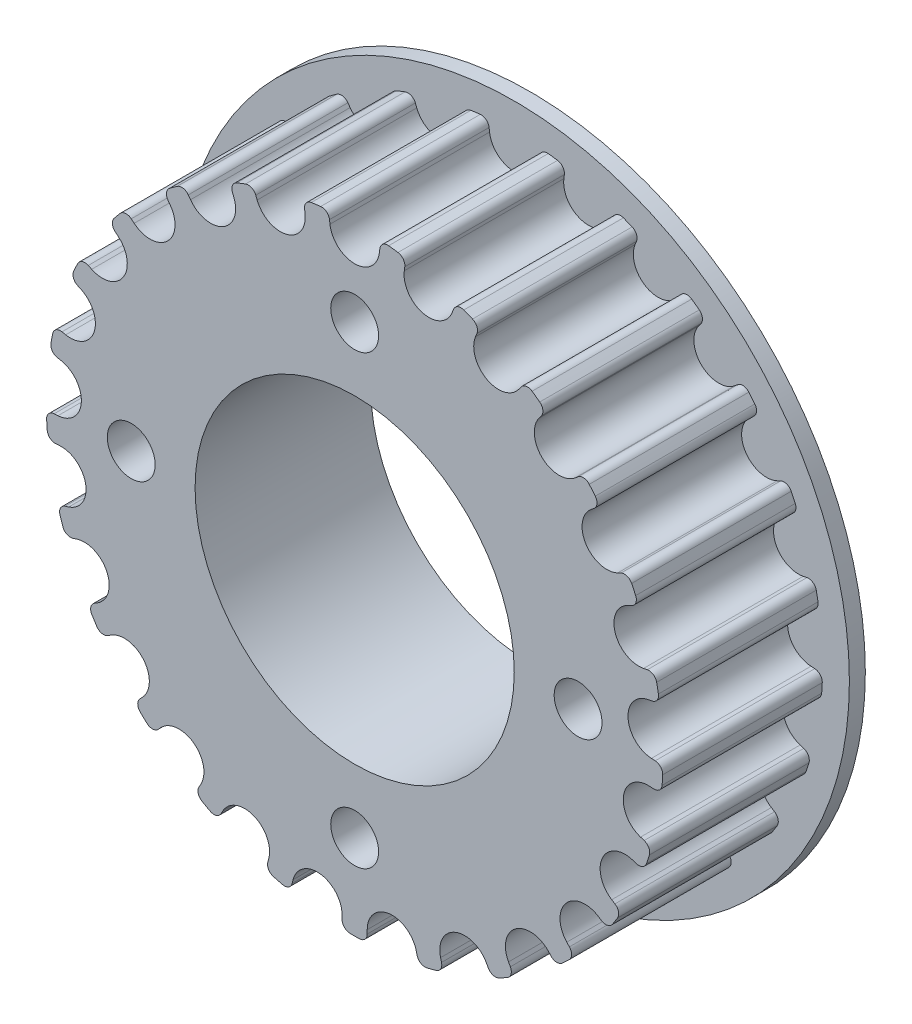
from build123d import *

# Parameters (mm, degrees)
SKETCH_1_R               = 19.894367886
EXTRUDE_1_DEPTH          = 10
CUT_EXTRUDE_1_DEPTH      = 30.859198703
PATTERN_CIRCULAR_1_COUNT = 25
EXTRUDE_START            = -10
SKETCH_3_R               = 21
EXTRUDE_3_DEPTH          = 1
SKETCH_4_R               = 10
CUT_EXTRUDE_3_DEPTH      = 32.670175244
SKETCH_5_R               = 1.5
CUT_EXTRUDE_4_DEPTH      = 32.670175244


with BuildPart() as part:
    # 草图1 → 凸台-拉伸1 (new body)
    with BuildSketch(Plane.XY):
        Circle(SKETCH_1_R)
    extrude(amount=EXTRUDE_1_DEPTH)

    # 草图2 → 切除-拉伸1 (cut, through all)
    with BuildSketch(Plane.XY.offset(10)):
        with BuildLine():
            Line((1.577407148, 18.768724044), (1.548371997, 18.532251711))
            ThreePointArc((1.548371997, 18.532251711), (0, 17.162367886), (-1.548371997, 18.532251711))
            Line((-1.548371997, 18.532251711), (-1.577407148, 18.768724044))
            ThreePointArc((-1.577407148, 18.768724044), (-1.763534561, 19.099975129), (-2.128765754, 19.204745692))
            ThreePointArc((-2.128765754, 19.204745692), (-2.275316606, 19.187934623), (-2.421734847, 19.170005244))
            Line((-2.421734847, 19.170005244), (-2.493425457, 19.737494854))
            ThreePointArc((-2.493425457, 19.737494854), (0, 19.894367886), (2.493425457, 19.737494854))
            Line((2.493425457, 19.737494854), (2.421734847, 19.170005244))
            ThreePointArc((2.421734847, 19.170005244), (2.275316606, 19.187934623), (2.128765754, 19.204745692))
            ThreePointArc((2.128765754, 19.204745692), (1.763534561, 19.099975129), (1.577407148, 18.768724044))
        make_face()
    cut_extrude_1 = extrude(amount=-CUT_EXTRUDE_1_DEPTH, mode=Mode.SUBTRACT)

    # 阵列(圆周)1: 切除-拉伸1 ×25 about axis
    pattern_circular_1_axis = Axis((0, 0, 0), (0, 0, 1))
    for i in range(1, PATTERN_CIRCULAR_1_COUNT):
        add(cut_extrude_1.rotate(pattern_circular_1_axis, i * 360 / PATTERN_CIRCULAR_1_COUNT), mode=Mode.SUBTRACT)

    # 草图3 → 凸台-拉伸3 (add)
    with BuildSketch(Plane.XY.offset(10).offset(EXTRUDE_START)):
        Circle(SKETCH_3_R)
    extrude(amount=-EXTRUDE_3_DEPTH)

    # 草图4 → 切除-拉伸3 (cut, through all)
    with BuildSketch(Plane(origin=(0, 0, -1), x_dir=(-1, 0, 0), z_dir=(0, 0, -1))):
        Circle(SKETCH_4_R)
    extrude(amount=-CUT_EXTRUDE_3_DEPTH, mode=Mode.SUBTRACT)

    # 草图5 → 切除-拉伸4 (cut, through all)
    with BuildSketch(Plane(origin=(0, 0, -1), x_dir=(-1, 0, 0), z_dir=(0, 0, -1))):
        with Locations((14, 0)):
            Circle(SKETCH_5_R)
        with Locations((0, -14)):
            Circle(SKETCH_5_R)
        with Locations((-14, 0)):
            Circle(SKETCH_5_R)
        with Locations((0, 14)):
            Circle(SKETCH_5_R)
    extrude(amount=-CUT_EXTRUDE_4_DEPTH, mode=Mode.SUBTRACT)


solid = part.part
